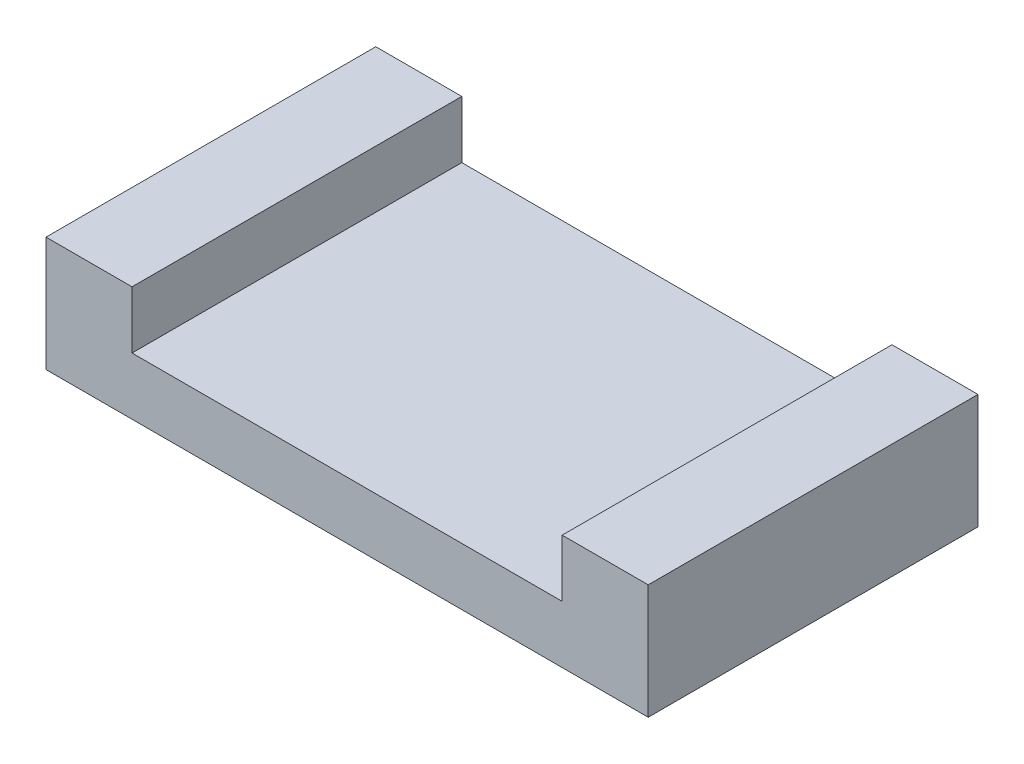
from build123d import *

# Parameters (mm, degrees)
SKETCH1_W           = 210
SKETCH1_H           = 115
BOSS_EXTRUDE1_DEPTH = 20
SKETCH3_W           = 30
SKETCH3_H           = 115
BOSS_EXTRUDE2_DEPTH = 20


with BuildPart() as part:
    # Sketch1 → Boss-Extrude1 (new body)
    with BuildSketch(Plane(origin=(0, 0, 0), x_dir=(1, 0, 0), z_dir=(0, 1, 0))):
        Rectangle(SKETCH1_W, SKETCH1_H)
    extrude(amount=BOSS_EXTRUDE1_DEPTH)

    # Sketch3 → Boss-Extrude2 (add)
    with BuildSketch(Plane(origin=(0, 20, 0), x_dir=(1, 0, 0), z_dir=(0, 1, 0))):
        with Locations((-90, 0)):
            Rectangle(SKETCH3_W, SKETCH3_H)
        with Locations((90, 0)):
            Rectangle(SKETCH3_W, SKETCH3_H)
    extrude(amount=BOSS_EXTRUDE2_DEPTH)


solid = part.part
